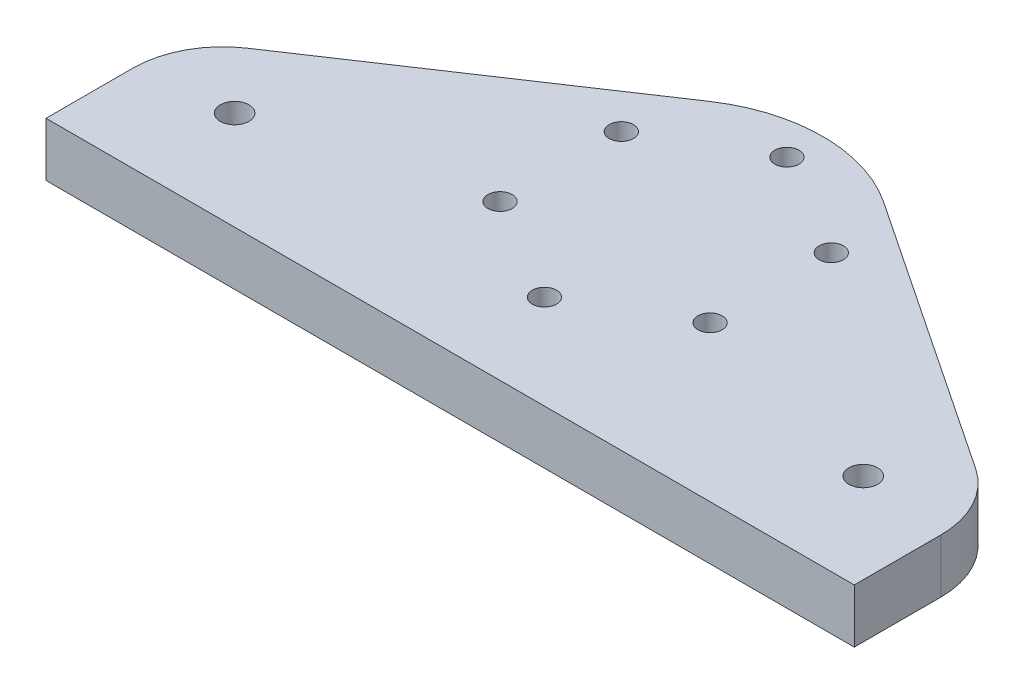
from build123d import *

# Parameters (mm, degrees)
EXTRUDE_1_DEPTH     = 6
SKETCH_2_R          = 1.35
CUT_EXTRUDE_1_DEPTH = 6
FILLET_1_R          = 10
SKETCH_3_R          = 1.6
CUT_EXTRUDE_2_DEPTH = 6


with BuildPart() as part:
    # 草图1 → 凸台-拉伸1 (new body)
    with BuildSketch(Plane(origin=(0, 0, 0), x_dir=(1, 0, 0), z_dir=(0, 1, 0))):
        with BuildLine():
            Line((-9.716498114, 14.55471279), (-45, -9))
            Line((-45, -9), (-45, -24))
            Line((-45, -24), (45, -24))
            Line((45, -24), (45, -9))
            Line((45, -9), (9.716498114, 14.55471279))
            ThreePointArc((9.716498114, 14.55471279), (0, 17.5), (-9.716498114, 14.55471279))
        make_face()
    extrude(amount=EXTRUDE_1_DEPTH)

    # 草图2 → 切除-拉伸1 (cut)
    with BuildSketch(Plane(origin=(0, 6, 0), x_dir=(1, 0, 0), z_dir=(0, 1, 0))):
        with Locations(Location((0, 13.5, 0), (0, 0, 270))):
            Circle(SKETCH_2_R)
        with Locations(Location((11.691342951, 6.75, 0), (0, 0, 270))):
            Circle(SKETCH_2_R)
        with Locations(Location((11.691342951, -6.75, 0), (0, 0, 270))):
            Circle(SKETCH_2_R)
        with Locations(Location((0, -13.5, 0), (0, 0, 270))):
            Circle(SKETCH_2_R)
        with Locations(Location((-11.691342951, -6.75, 0), (0, 0, 270))):
            Circle(SKETCH_2_R)
        with Locations(Location((-11.691342951, 6.75, 0), (0, 0, 270))):
            Circle(SKETCH_2_R)
    extrude(amount=-CUT_EXTRUDE_1_DEPTH, mode=Mode.SUBTRACT)

    # 圆角1
    fillet_1_edges = [part.edges().sort_by_distance(p)[0] for p in [
        (45, 3, 9),
        (-45, 3, 9),
    ]]
    fillet(fillet_1_edges, radius=FILLET_1_R)

    # 草图3 → 切除-拉伸2 (cut)
    with BuildSketch(Plane.XZ):
        with Locations(Location((-35, 13, 0), (0, 0, 270))):
            Circle(SKETCH_3_R)
        with Locations(Location((35, 13, 0), (0, 0, 90))):
            Circle(SKETCH_3_R)
    extrude(amount=-CUT_EXTRUDE_2_DEPTH, mode=Mode.SUBTRACT)


solid = part.part
